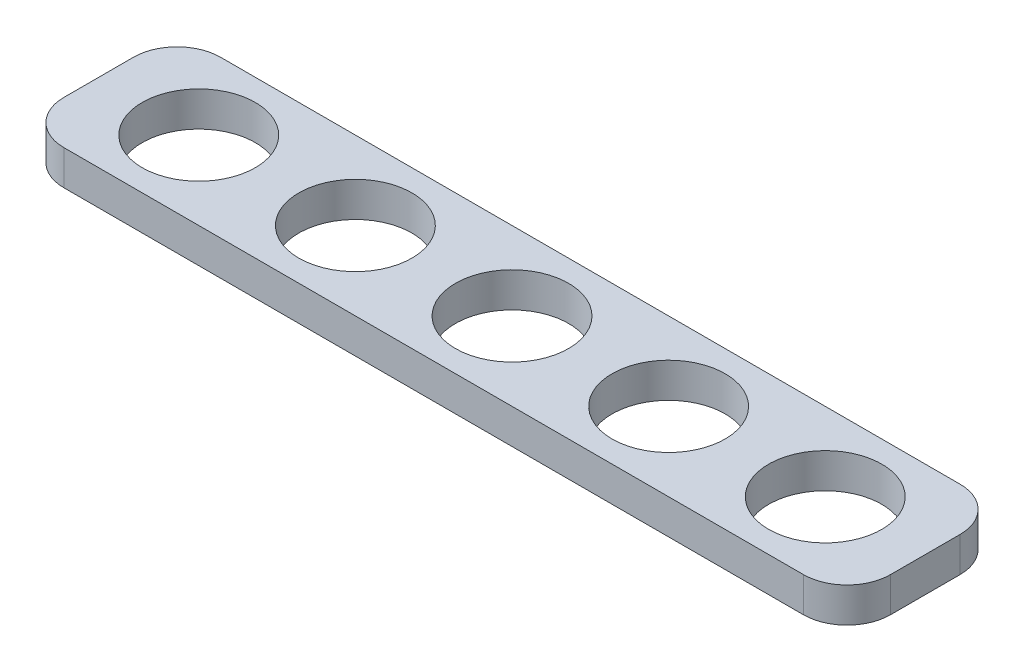
from build123d import *

# Parameters (mm, degrees)
SKETCH5_W           = 190
SKETCH5_H           = 36
BOSS_EXTRUDE1_DEPTH = 8
SKETCH6_R           = 13
SKETCH6_R_2         = 12.99768992
CUT_EXTRUDE1_DEPTH  = 8
FILLET2_R           = 10


with BuildPart() as part:
    # Sketch5 → Boss-Extrude1 (new body)
    with BuildSketch(Plane(origin=(0, 0, 0), x_dir=(1, 0, 0), z_dir=(0, 1, 0))):
        with Locations((95, 18)):
            Rectangle(SKETCH5_W, SKETCH5_H)
    extrude(amount=BOSS_EXTRUDE1_DEPTH)

    # Sketch6 → Cut-Extrude1 (cut)
    with BuildSketch(Plane(origin=(0, 8, 0), x_dir=(1, 0, 0), z_dir=(0, 1, 0))):
        with Locations(Location((23, 18, 0), (0, 0, 270))):
            Circle(SKETCH6_R)
        with Locations(Location((59, 18, 0), (0, 0, 270))):
            Circle(SKETCH6_R)
        with Locations(Location((95.004620161, 18, 0), (0, 0, 270))):
            Circle(SKETCH6_R)
        with Locations(Location((131.004620161, 18, 0), (0, 0, 270))):
            Circle(SKETCH6_R)
        with Locations(Location((167.00231008, 18, 0), (0, 0, 270))):
            Circle(SKETCH6_R_2)
    extrude(amount=-CUT_EXTRUDE1_DEPTH, mode=Mode.SUBTRACT)

    # Fillet2
    fillet2_edges = [part.edges().sort_by_distance(p)[0] for p in [
        (0, 4, -36),
        (190, 4, -36),
        (190, 4, 0),
        (0, 4, 0),
    ]]
    fillet(fillet2_edges, radius=FILLET2_R)


solid = part.part
